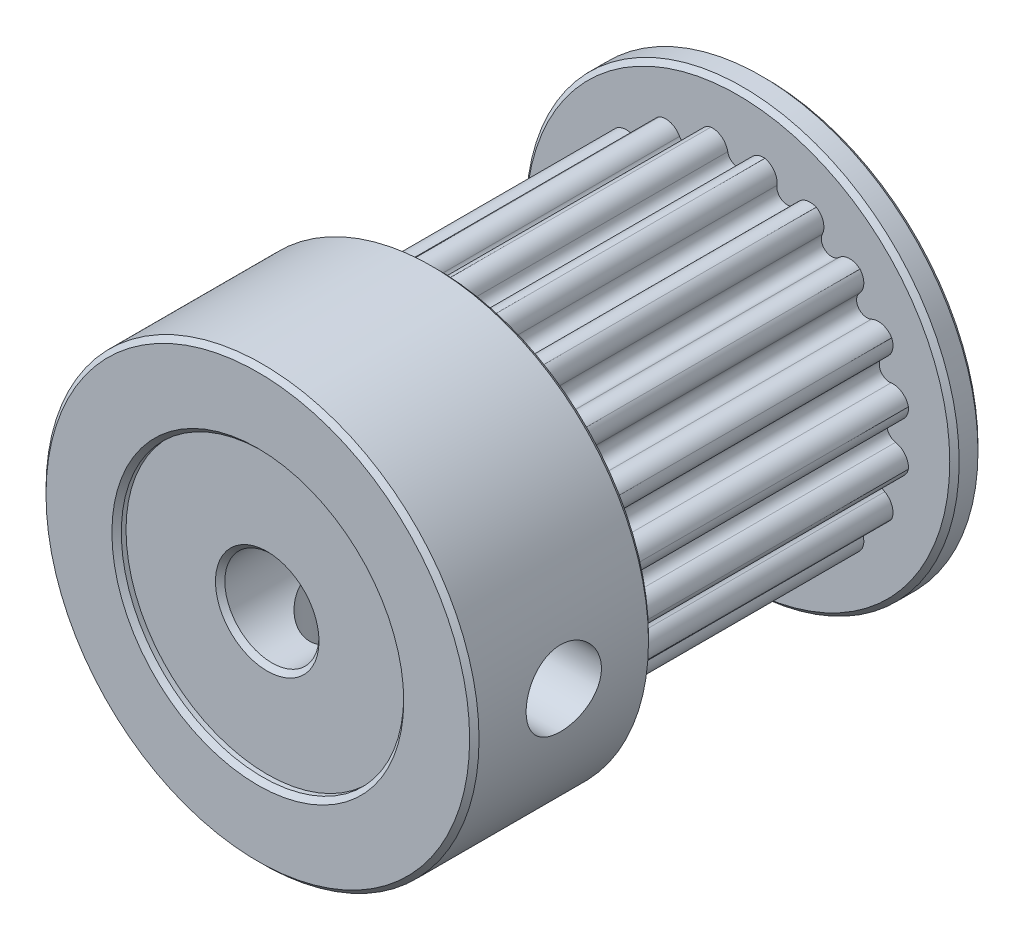
from build123d import *

# Parameters (mm, degrees)
ESQUISSE1_R                  = 11.5
ESQUISSE1_R_2                = 2.5
BOSS_EXTRU_1_DEPTH           = 27
ESQUISSE2_R                  = 11.5
ESQUISSE2_R_2                = 9.17
ENL_V_MAT_EXTRU_1_DEPTH      = 16
ENL_V_START                  = 16
ENL_V_MAT_EXTRU_2_DEPTH      = 16
R_P_TITION_CIRCULAIRE1_COUNT = 20
ESQUISSE4_R                  = 2
ENL_V_MAT_EXTRU_3_DEPTH      = 16
R_P_TITION_CIRCULAIRE2_COUNT = 2
R_P_TITION_CIRCULAIRE2_ANGLE = 90
ESQUISSE5_R                  = 7.5
ENL_V_MAT_EXTRU_4_DEPTH      = 0.5
CHANFREIN1_SIZE              = 0.25


with BuildPart() as part:
    # Esquisse1 → Boss.-Extru.1 (new body)
    with BuildSketch(Plane.XY):
        Circle(ESQUISSE1_R)
        Circle(ESQUISSE1_R_2, mode=Mode.SUBTRACT)
    extrude(amount=BOSS_EXTRU_1_DEPTH)

    # Esquisse2 → Enlèv. mat.-Extru.1 (cut)
    with BuildSketch(Plane(origin=(0, 0, 1.5), x_dir=(-1, 0, 0), z_dir=(0, 0, -1))):
        Circle(ESQUISSE2_R)
        Circle(ESQUISSE2_R_2, mode=Mode.SUBTRACT)
    extrude(amount=-ENL_V_MAT_EXTRU_1_DEPTH, mode=Mode.SUBTRACT)

    # Esquisse3 → Enlèv. mat.-Extru.2 (cut)
    with BuildSketch(Plane(origin=(0, 0, 17.5), x_dir=(-1, 0, 0), z_dir=(0, 0, -1)).offset(ENL_V_START)):
        with BuildLine():
            ThreePointArc((-1.5, 9.046485505), (-0.88232463, 8.905445978), (-0.541125011, 8.371594096))
            ThreePointArc((-0.541125011, 8.371594096), (0, 7.92), (0.541125011, 8.371594096))
            ThreePointArc((0.541125011, 8.371594096), (0.88232463, 8.905445978), (1.5, 9.046485505))
            ThreePointArc((1.5, 9.046485505), (0, 9.17), (-1.5, 9.046485505))
        make_face()
    enl_v_mat_extru_2 = extrude(amount=-ENL_V_MAT_EXTRU_2_DEPTH, mode=Mode.SUBTRACT)

    # Répétition circulaire1: Enlèv. mat.-Extru.2 ×20 about axis
    r_p_tition_circulaire1_axis = Axis((0, 0, 0), (0, 0, 1))
    for i in range(1, R_P_TITION_CIRCULAIRE1_COUNT):
        add(enl_v_mat_extru_2.rotate(r_p_tition_circulaire1_axis, i * 360 / R_P_TITION_CIRCULAIRE1_COUNT), mode=Mode.SUBTRACT)

    # Esquisse4 → Enlèv. mat.-Extru.3 (cut)
    with BuildSketch(Plane(origin=(0, 0, 0), x_dir=(1, 0, 0), z_dir=(0, 1, 0))):
        with Locations(Location((0, -22.25, 0), (0, 0, 270))):
            Circle(ESQUISSE4_R)
    enl_v_mat_extru_3 = extrude(amount=-ENL_V_MAT_EXTRU_3_DEPTH, mode=Mode.SUBTRACT)

    # Répétition circulaire2: Enlèv. mat.-Extru.3 ×2 about axis
    r_p_tition_circulaire2_axis = Axis((0, 0, 27), (0, 0, 1))
    for i in range(1, R_P_TITION_CIRCULAIRE2_COUNT):
        add(enl_v_mat_extru_3.rotate(r_p_tition_circulaire2_axis, i * R_P_TITION_CIRCULAIRE2_ANGLE / (R_P_TITION_CIRCULAIRE2_COUNT - 1)), mode=Mode.SUBTRACT)

    # Esquisse5 → Enlèv. mat.-Extru.4 (cut)
    with BuildSketch(Plane(origin=(0, 0, 0), x_dir=(-1, 0, 0), z_dir=(0, 0, -1))):
        Circle(ESQUISSE5_R)
    enl_v_mat_extru_4 = extrude(amount=-ENL_V_MAT_EXTRU_4_DEPTH, mode=Mode.SUBTRACT)

    # Symétrie1: Enlèv. mat.-Extru.4 across plane
    add(enl_v_mat_extru_4.mirror(Plane(origin=(0, 0, 13.5), x_dir=(1, 0, 0), z_dir=(0, 0, -1))), mode=Mode.SUBTRACT)

    # Chanfrein1
    chanfrein1_edges = [part.edges().sort_by_distance(p)[0] for p in [
        (-11.5, 0, 17.5),
        (-11.5, 0, 1.5),
        (-2.5, 0, 0.5),
        (7.5, 0, 0),
        (-11.5, 0, 0),
        (7.5, 0, 27),
        (-2.5, 0, 26.5),
        (-11.5, 0, 27),
    ]]
    chamfer(chanfrein1_edges, length=CHANFREIN1_SIZE)


solid = part.part
